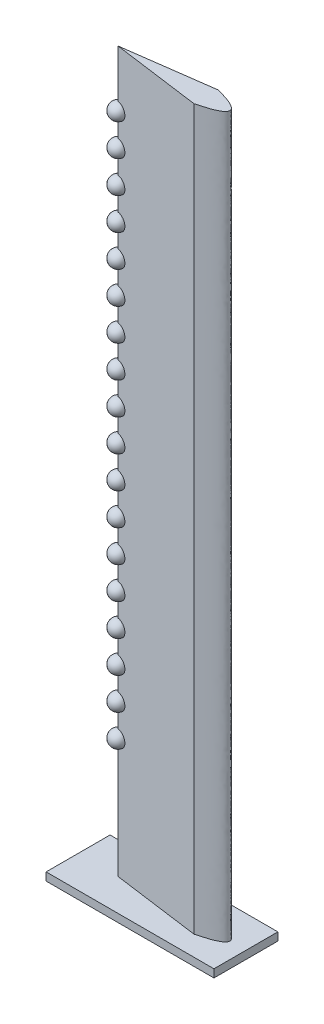
from build123d import *
from build123d.topology import SkipClean

# Parameters (mm, degrees)
EXTRUDE_1_DEPTH        = 900
SKETCH_2_W             = 210
SKETCH_2_H             = 80
EXTRUDE_2_DEPTH        = 10
PATTERN_LINEAR_1_COUNT = 18
PATTERN_LINEAR_1_PITCH = 40


with BuildPart() as part:
    # 草图1 → 凸台-拉伸1 (new body)
    with BuildSketch(Plane(origin=(0, 0, 0), x_dir=(1, 0, 0), z_dir=(0, 1, 0))):
        with BuildLine():
            Line((0, 0), (110, 15))
            add(Edge.make_bspline(
                [(110, 15), (170, 0), (110, -15)],
                knots=[0, 0, 0, 1, 1, 1], degree=2))
            Line((110, -15), (0, 0))
        make_face()
    extrude(amount=EXTRUDE_1_DEPTH)

    # 草图2 → 凸台-拉伸2 (add)
    with BuildSketch(Plane.XZ):
        with Locations((55, 0)):
            Rectangle(SKETCH_2_W, SKETCH_2_H)
    extrude(amount=EXTRUDE_2_DEPTH)

    # 草图3 one side → 旋转2 (revolve)
    with SkipClean():  # the faces are left unmerged after this step: merging them gives an invalid solid
        with BuildSketch(Plane(origin=(0, 0, 0), x_dir=(0.990830168044299, 0, 0.13511320473331348), z_dir=(-0.13511320473331345, 0, 0.9908301680442989))):
            with BuildLine():
                ThreePointArc((0, 140), (7.071067812, 142.928932188), (10, 150))
                ThreePointArc((10, 150), (7.071067812, 157.071067812), (0, 160))
                Line((0, 160), (0, 140))
            make_face()
        revolve_2 = revolve(axis=Axis((0, 900, 0), (0, -1, 0)))

    # 阵列(线性)1: 旋转2 ×18
    with SkipClean():  # the faces are left unmerged after this step: merging them gives an invalid solid
        with Locations(*[(0, i * PATTERN_LINEAR_1_PITCH, 0) for i in range(1, PATTERN_LINEAR_1_COUNT)]):
            add(revolve_2)


solid = part.part
